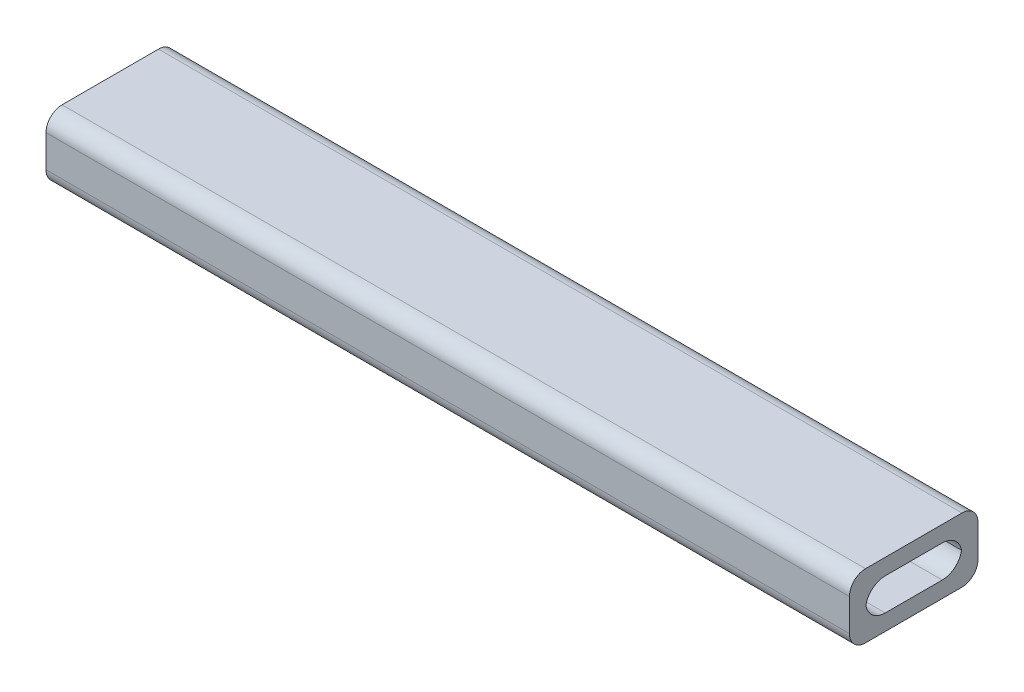
from build123d import *

# Parameters (mm, degrees)
BOSS_EXTRUDE1_DEPTH = 125


with BuildPart() as part:
    # Sketch1 → Boss-Extrude1 (new, symmetric)
    with BuildSketch(Plane(origin=(0, 0, 0), x_dir=(0, 0, -1), z_dir=(1, 0, 0))):
        with BuildLine():
            Line((-15, 10), (15, 10))
            ThreePointArc((15, 10), (18.535533906, 8.535533906), (20, 5))
            Line((20, 5), (20, -5))
            ThreePointArc((20, -5), (18.535533906, -8.535533906), (15, -10))
            Line((15, -10), (-15, -10))
            ThreePointArc((-15, -10), (-18.535533906, -8.535533906), (-20, -5))
            Line((-20, -5), (-20, 5))
            ThreePointArc((-20, 5), (-18.535533906, 8.535533906), (-15, 10))
        make_face()
        with BuildLine():
            Line((-8.870332019, 5), (8.870332019, 5))
            ThreePointArc((8.870332019, 5), (12.784941828, 3.587180501), (14.895004608, 0))
            ThreePointArc((14.895004608, 0), (12.784941828, -3.587180501), (8.870332019, -5))
            Line((8.870332019, -5), (-8.870332019, -5))
            ThreePointArc((-8.870332019, -5), (-12.784941828, -3.587180501), (-14.895004608, 0))
            ThreePointArc((-14.895004608, 0), (-12.784941828, 3.587180501), (-8.870332019, 5))
        make_face(mode=Mode.SUBTRACT)
    extrude(amount=BOSS_EXTRUDE1_DEPTH, both=True)


solid = part.part
